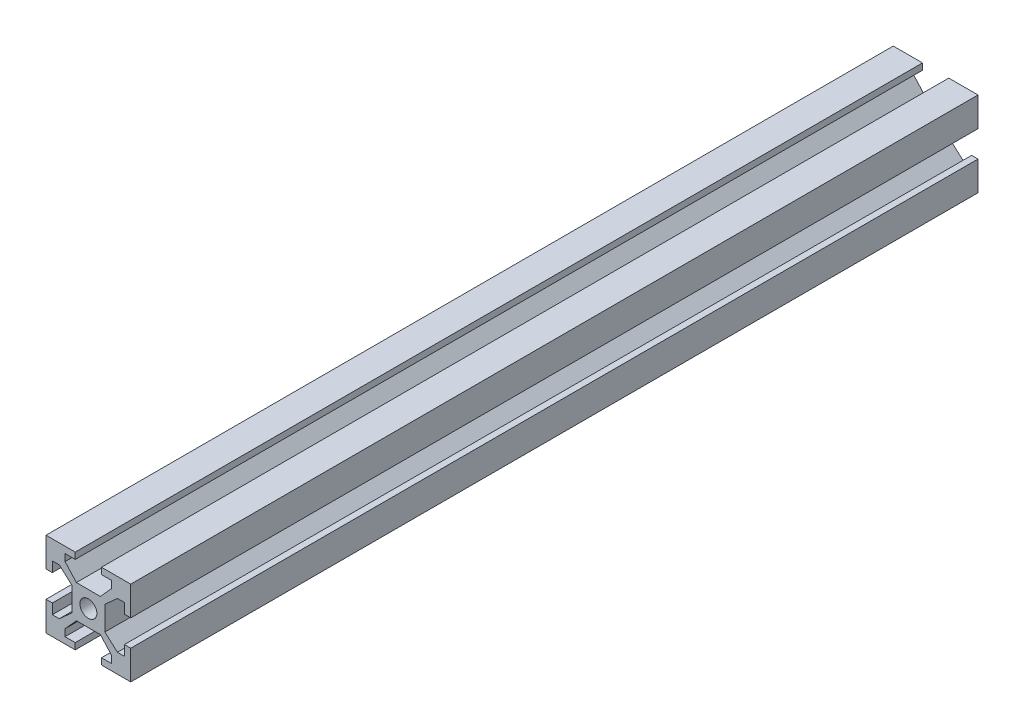
from build123d import *

# Parameters (mm, degrees)
SKETCH1_R           = 2
BOSS_EXTRUDE1_DEPTH = 100


with BuildPart() as part:
    # Sketch1 → Boss-Extrude1 (new, symmetric)
    with BuildSketch(Plane.XY):
        Polygon((10, 4.610379336), (10, 10), (4.610379336, 10), (3.1, 10), (3.1, 8.5), (5.5, 8.5), (5.5, 6.860660172), (2.839339828, 3.9), (0.519615242, 3.9), (-0.519615242, 3.9), (-2.839339828, 3.9), (-5.5, 6.860660172), (-5.5, 8.5), (-3.1, 8.5), (-3.1, 10), (-4.610379336, 10), (-10, 10), (-10, 4.610379336), (-10, 3.1), (-8.5, 3.1), (-8.5, 5.5), (-6.860660172, 5.5), (-3.9, 2.839339828), (-3.9, 0.519615242), (-3.9, -0.519615242), (-3.9, -2.839339828), (-6.860660172, -5.5), (-8.5, -5.5), (-8.5, -3.1), (-10, -3.1), (-10, -4.610379336), (-10, -10), (-4.610379336, -10), (-3.1, -10), (-3.1, -8.5), (-5.5, -8.5), (-5.5, -6.860660172), (-2.839339828, -3.9), (-0.519615242, -3.9), (0.519615242, -3.9), (2.839339828, -3.9), (5.5, -6.860660172), (5.5, -8.5), (3.1, -8.5), (3.1, -10), (4.610379336, -10), (10, -10), (10, -4.610379336), (10, -3.1), (8.5, -3.1), (8.5, -5.5), (6.860660172, -5.5), (3.9, -2.839339828), (3.9, -0.519615242), (3.9, 0.519615242), (3.9, 2.839339828), (6.860660172, 5.5), (8.5, 5.5), (8.5, 3.1), (10, 3.1), align=None)
        Circle(SKETCH1_R, mode=Mode.SUBTRACT)
    extrude(amount=BOSS_EXTRUDE1_DEPTH, both=True)


solid = part.part
